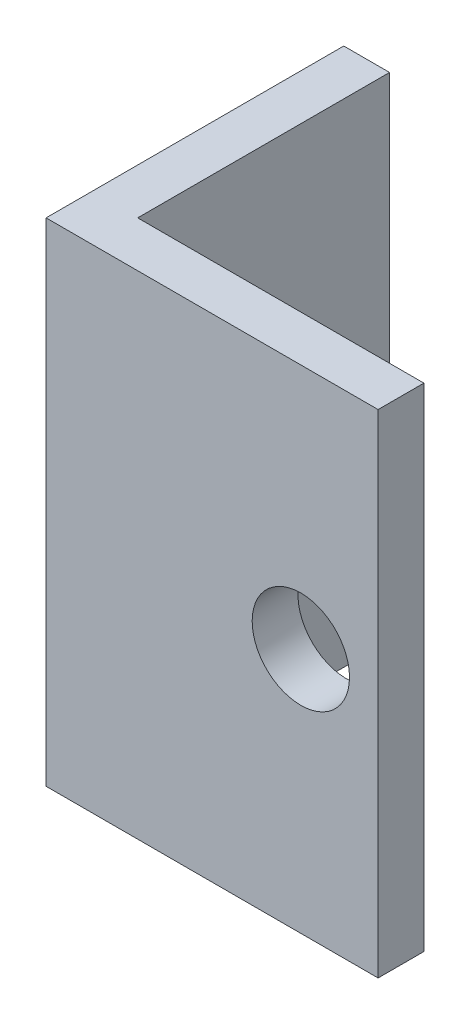
from build123d import *

# Parameters (mm, degrees)
CROQUIS1_W              = 25
CROQUIS1_H              = 3
SALIENTE_EXTRUIR1_DEPTH = 195
CROQUIS2_R              = 4.25
CORTAR_EXTRUIR1_DEPTH   = 195
CROQUIS3_W              = 4
CROQUIS3_H              = 25
SALIENTE_EXTRUIR2_DEPTH = 195
SALIENTE_EXTRUIR3_START = 1
CROQUIS4_W              = 29
CROQUIS4_H              = 195
CROQUIS4_R              = 4.25
SALIENTE_EXTRUIR3_DEPTH = 1
CROQUIS5_W              = 149.811438776
CROQUIS5_H              = 152
CORTAR_EXTRUIR4_DEPTH   = 40
CROQUIS6_R              = 4.25
CORTAR_EXTRUIR5_DEPTH   = 40
SALIENTE_EXTRUIR4_DEPTH = 4


with BuildPart() as part:
    # Croquis1 → Saliente-Extruir1 (new body)
    with BuildSketch(Plane(origin=(0, 0, 0), x_dir=(1, 0, 0), z_dir=(0, 1, 0))):
        with Locations((12.5, -1.5)):
            Rectangle(CROQUIS1_W, CROQUIS1_H)
    extrude(amount=SALIENTE_EXTRUIR1_DEPTH)

    # Croquis2 → Cortar-Extruir1 (cut)
    with BuildSketch(Plane.XY.offset(3)):
        with Locations((18.25, 180)):
            Circle(CROQUIS2_R)
        with Locations((18.25, 97.5)):
            Circle(CROQUIS2_R)
        with Locations((18.25, 15)):
            Circle(CROQUIS2_R)
    extrude(amount=-CORTAR_EXTRUIR1_DEPTH, mode=Mode.SUBTRACT)

    # Croquis3 → Saliente-Extruir2 (add)
    with BuildSketch(Plane(origin=(0, 195, 0), x_dir=(1, 0, 0), z_dir=(0, 1, 0))):
        with Locations((-2, 9.5)):
            Rectangle(CROQUIS3_W, CROQUIS3_H)
    extrude(amount=-SALIENTE_EXTRUIR2_DEPTH)

    # Croquis4 → Saliente-Extruir3 (add)
    with BuildSketch(Plane.XY.offset(3).offset(SALIENTE_EXTRUIR3_START)):
        with Locations((10.5, 97.5)):
            Rectangle(CROQUIS4_W, CROQUIS4_H)
        with Locations((18.25, 15)):
            Circle(CROQUIS4_R, mode=Mode.SUBTRACT)
        with Locations((18.25, 97.5)):
            Circle(CROQUIS4_R, mode=Mode.SUBTRACT)
        with Locations((18.25, 180)):
            Circle(CROQUIS4_R, mode=Mode.SUBTRACT)
    extrude(amount=-SALIENTE_EXTRUIR3_DEPTH)

    # Croquis5 → Cortar-Extruir4 (cut)
    with BuildSketch(Plane.XY.offset(4)):
        with Locations((-49.905719388, 76)):
            Rectangle(CROQUIS5_W, CROQUIS5_H)
    extrude(amount=-CORTAR_EXTRUIR4_DEPTH, mode=Mode.SUBTRACT)

    # Croquis6 → Cortar-Extruir5 (cut)
    with BuildSketch(Plane.XY.offset(4)):
        with Locations((18.25, 173.5)):
            Circle(CROQUIS6_R)
    extrude(amount=-CORTAR_EXTRUIR5_DEPTH, mode=Mode.SUBTRACT)

    # Croquis7 → Saliente-Extruir4 (add)
    with BuildSketch(Plane.XY.offset(4)):
        with BuildLine():
            ThreePointArc((20.988612788, 176.75), (22.103673854, 178.207878959), (22.5, 180))
            ThreePointArc((22.5, 180), (16.457878959, 183.853673854), (15.511387212, 176.75))
            ThreePointArc((15.511387212, 176.75), (18.25, 177.75), (20.988612788, 176.75))
        make_face()
    extrude(amount=-SALIENTE_EXTRUIR4_DEPTH)


solid = part.part
